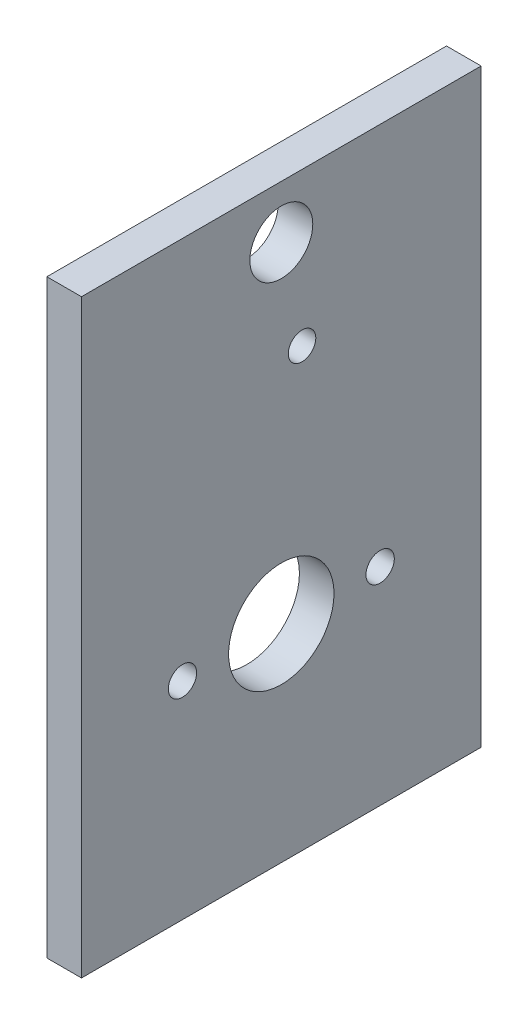
from build123d import *

# Parameters (mm, degrees)
SKETCH1_W           = 50.8
SKETCH1_H           = 75
BOSS_EXTRUDE1_DEPTH = 4.4
SKETCH2_R           = 4
SKETCH2_R_2         = 6.7
SKETCH2_R_3         = 1.8
CUT_EXTRUDE1_DEPTH  = 46.505713927
SKETCH4_R           = 1.75
CUT_EXTRUDE2_DEPTH  = 46.505713927


with BuildPart() as part:
    # Sketch1 → Boss-Extrude1 (new body)
    with BuildSketch(Plane(origin=(0, 0, 0), x_dir=(0, 0, -1), z_dir=(1, 0, 0))):
        Rectangle(SKETCH1_W, SKETCH1_H)
    extrude(amount=BOSS_EXTRUDE1_DEPTH)

    # Sketch2 → Cut-Extrude1 (cut, through all)
    with BuildSketch(Plane(origin=(4.4, 0, 0), x_dir=(0, 0, -1), z_dir=(1, 0, 0))):
        with Locations((0, 30.794503628)):
            Circle(SKETCH2_R)
        with Locations((0, -11.205496372)):
            Circle(SKETCH2_R_2)
        with Locations((-12.565, -11.205496372)):
            Circle(SKETCH2_R_3)
        with Locations((12.565, -11.205496372)):
            Circle(SKETCH2_R_3)
    extrude(amount=-CUT_EXTRUDE1_DEPTH, mode=Mode.SUBTRACT)

    # Sketch4 → Cut-Extrude2 (cut, through all)
    with BuildSketch(Plane(origin=(4.4, 0, 0), x_dir=(0, 0, -1), z_dir=(1, 0, 0))):
        with Locations((2.63504704, 18.069503628)):
            Circle(SKETCH4_R)
    extrude(amount=-CUT_EXTRUDE2_DEPTH, mode=Mode.SUBTRACT)


solid = part.part
